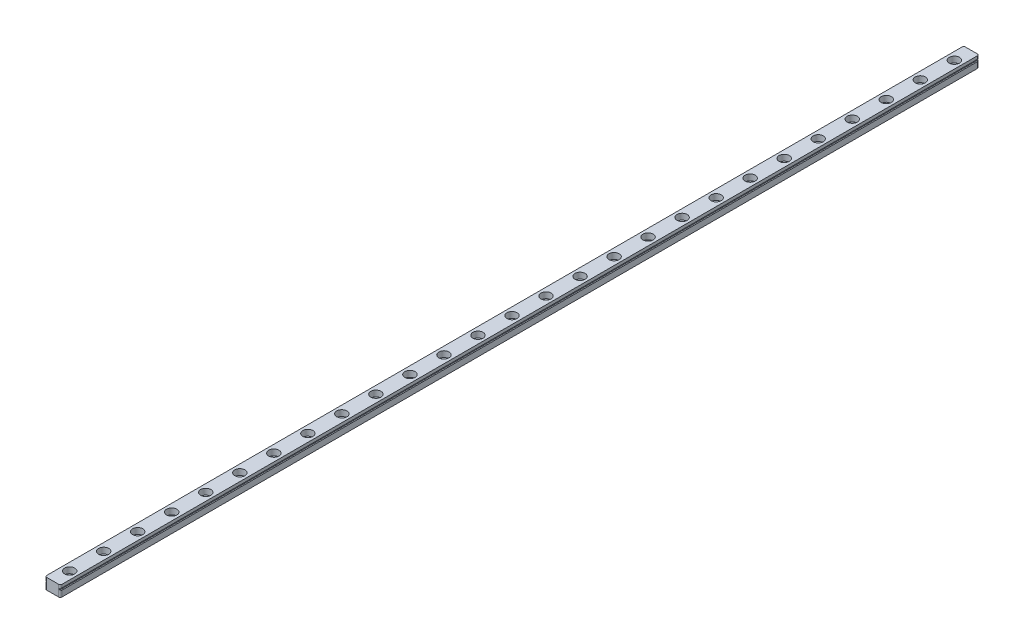
from build123d import *

# Parameters (mm, degrees)
EXTRUDE_1_DEPTH        = 540
SKETCH_2_R             = 3
CUT_EXTRUDE_1_DEPTH    = 3.5
SKETCH_3_R             = 1.75
CUT_EXTRUDE_2_DEPTH    = 541.030091754
PATTERN_LINEAR_1_COUNT = 30
PATTERN_LINEAR_1_PITCH = 20
FILLET_1_R             = 1


with BuildPart() as part:
    # 草图1 → 凸台-拉伸1 (new body)
    with BuildSketch(Plane.XY):
        Polygon((-4.5, -3.663424778), (4.5, -3.663424778), (4.5, -0.163424778), (4.146446609, 0.190128613), (3.646446609, 0.190128613), (3.646446609, 0.690128613), (4.146446609, 0.690128613), (4.5, 1.043682003), (4.5, 2.836575222), (-4.5, 2.836575222), (-4.5, 1.043682003), (-4.146446609, 0.690128613), (-3.646446609, 0.690128613), (-3.646446609, 0.190128613), (-4.146446609, 0.190128613), (-4.5, -0.163424778), align=None)
    extrude(amount=EXTRUDE_1_DEPTH)

    # 草图2 → 切除-拉伸1 (cut)
    with BuildSketch(Plane(origin=(0, 2.836575222, 0), x_dir=(1, 0, 0), z_dir=(0, 1, 0))):
        with Locations(Location((0, -530, 0), (0, 0, 270))):
            Circle(SKETCH_2_R)
    cut_extrude_1 = extrude(amount=-CUT_EXTRUDE_1_DEPTH, mode=Mode.SUBTRACT)

    # 草图3 → 切除-拉伸2 (cut, through all)
    with BuildSketch(Plane(origin=(0, -0.663424778, 0), x_dir=(1, 0, 0), z_dir=(0, 1, 0))):
        with Locations(Location((0, -530, 0), (0, 0, 270))):
            Circle(SKETCH_3_R)
    cut_extrude_2 = extrude(amount=-CUT_EXTRUDE_2_DEPTH, mode=Mode.SUBTRACT)

    # 阵列(线性)1: 切除-拉伸1, 切除-拉伸2 ×30
    with Locations(*[(0, 0, -i * PATTERN_LINEAR_1_PITCH) for i in range(1, PATTERN_LINEAR_1_COUNT)]):
        add(cut_extrude_1, mode=Mode.SUBTRACT)
        add(cut_extrude_2, mode=Mode.SUBTRACT)

    # 圆角1
    fillet_1_edges = [part.edges().sort_by_distance(p)[0] for p in [
        (4.5, -1.913424778, 0),
        (-4.5, -1.913424778, 0),
        (4.5, -1.913424778, 540),
        (-4.5, -1.913424778, 540),
    ]]
    fillet(fillet_1_edges, radius=FILLET_1_R)


solid = part.part
